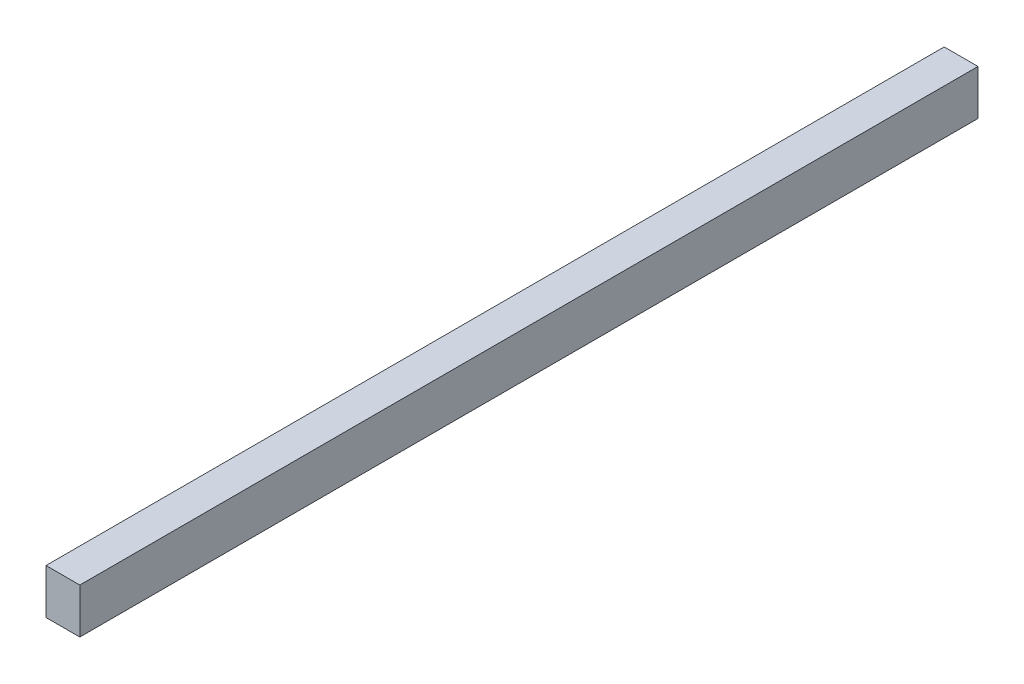
from build123d import *

# Parameters (mm, degrees)
SKETCH1_W           = 30
SKETCH1_H           = 40
BOSS_EXTRUDE1_DEPTH = 797


with BuildPart() as part:
    # Sketch1 → Boss-Extrude1 (new body)
    with BuildSketch(Plane.XY):
        with Locations((-28.302701728, 20)):
            Rectangle(SKETCH1_W, SKETCH1_H)
    extrude(amount=BOSS_EXTRUDE1_DEPTH)


solid = part.part
